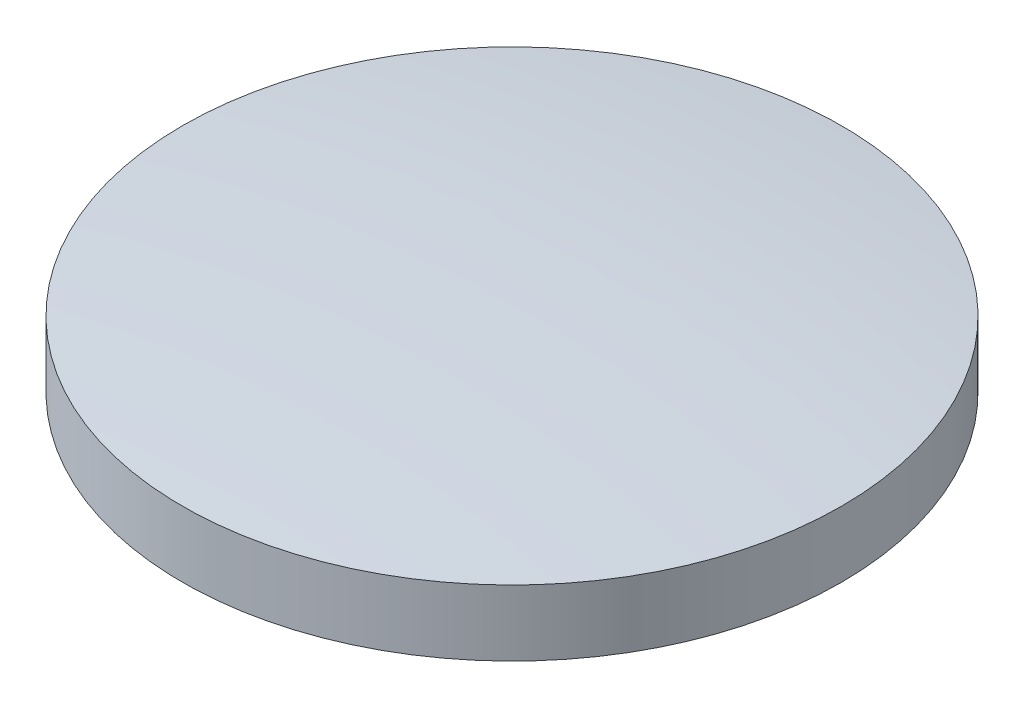
from build123d import *


with BuildPart() as part:
    # Sketch1 → Revolve1 (revolve)
    with BuildSketch(Plane.XY):
        with BuildLine():
            Line((-10, -1), (-10, 1))
            ThreePointArc((-10, 1), (-5.008991915, 1.449865242), (0, 1.6))
            Line((0, 1.6), (0, -0.409376454))
            ThreePointArc((0, -0.409376454), (-5.008850901, -0.554831335), (-10, -1))
        make_face()
    revolve(axis=Axis((0, 1.6, 0), (0, -1, 0)))


solid = part.part
